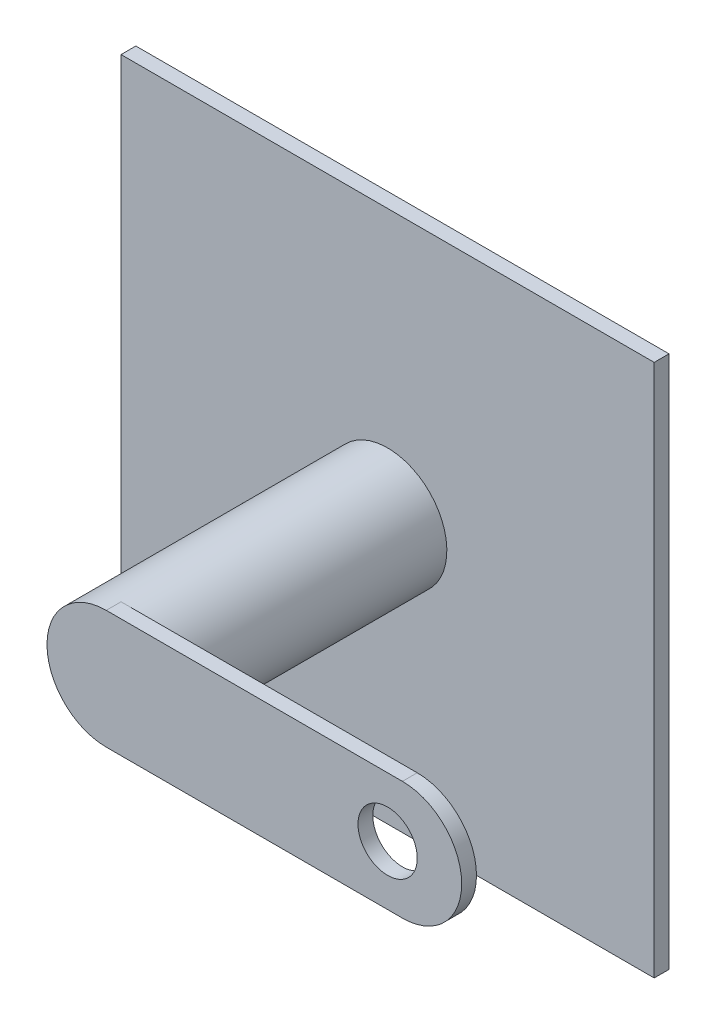
from build123d import *

# Parameters (mm, degrees)
SKETCH1_W             = 180
SKETCH1_H             = 180
BOSS_EXTRUDE1_DEPTH   = 5
SKETCH2_R             = 20
BOSS_EXTRUDE2_DEPTH   = 95
BOSS_EXTRUDE3_START   = -5
BOSS_EXTRUDE3_DEPTH   = 5
CUT_EXTRUDE1_REACH    = 182.278
SKETCH4_R             = 10
BODY_MOVE_COPY1_ANGLE = 90


with BuildPart() as part:
    # Sketch1 → Boss-Extrude1 (new body)
    with BuildSketch(Plane(origin=(0, 0, 0), x_dir=(1, 0, 0), z_dir=(0, 1, 0))):
        Rectangle(SKETCH1_W, SKETCH1_H)
    extrude(amount=BOSS_EXTRUDE1_DEPTH)

    # Sketch2 → Boss-Extrude2 (add)
    with BuildSketch(Plane(origin=(0, 5, 0), x_dir=(1, 0, 0), z_dir=(0, 1, 0))):
        with Locations(Location((0, 0, 0), (0, 0, 270))):
            Circle(SKETCH2_R)
    extrude(amount=BOSS_EXTRUDE2_DEPTH)

    # Sketch3 → Boss-Extrude3 (add)
    with BuildSketch(Plane(origin=(0, 100, 0), x_dir=(1, 0, 0), z_dir=(0, 1, 0)).offset(BOSS_EXTRUDE3_START)):
        with BuildLine():
            Line((0, 20), (100, 20))
            ThreePointArc((100, 20), (120, 0), (100, -20))
            Line((100, -20), (0, -20))
            ThreePointArc((0, -20), (-20, 0), (0, 20))
        make_face()
    extrude(amount=BOSS_EXTRUDE3_DEPTH)

    # Sketch4 → Cut-Extrude1 (cut, up to next)
    with BuildSketch(Plane(origin=(0, 100, 0), x_dir=(1, 0, 0), z_dir=(0, 1, 0)), mode=Mode.PRIVATE) as cut_extrude1_sk1:
        with Locations(Location((95, 0, 0), (0, 0, 270))):
            Circle(SKETCH4_R)
    cut_extrude1_tool1 = extrude(cut_extrude1_sk1.sketch, amount=-CUT_EXTRUDE1_REACH, mode=Mode.PRIVATE) & part.part
    add(cut_extrude1_tool1.solids().sort_by_distance((95, 100, 0))[0], mode=Mode.SUBTRACT)


with BuildPart() as part_1:
    # Body-Move/Copy1: moved
    add(part.part.rotate(Axis((0, 0, 0), (1, 0, 0)), BODY_MOVE_COPY1_ANGLE))


solid = part_1.part
